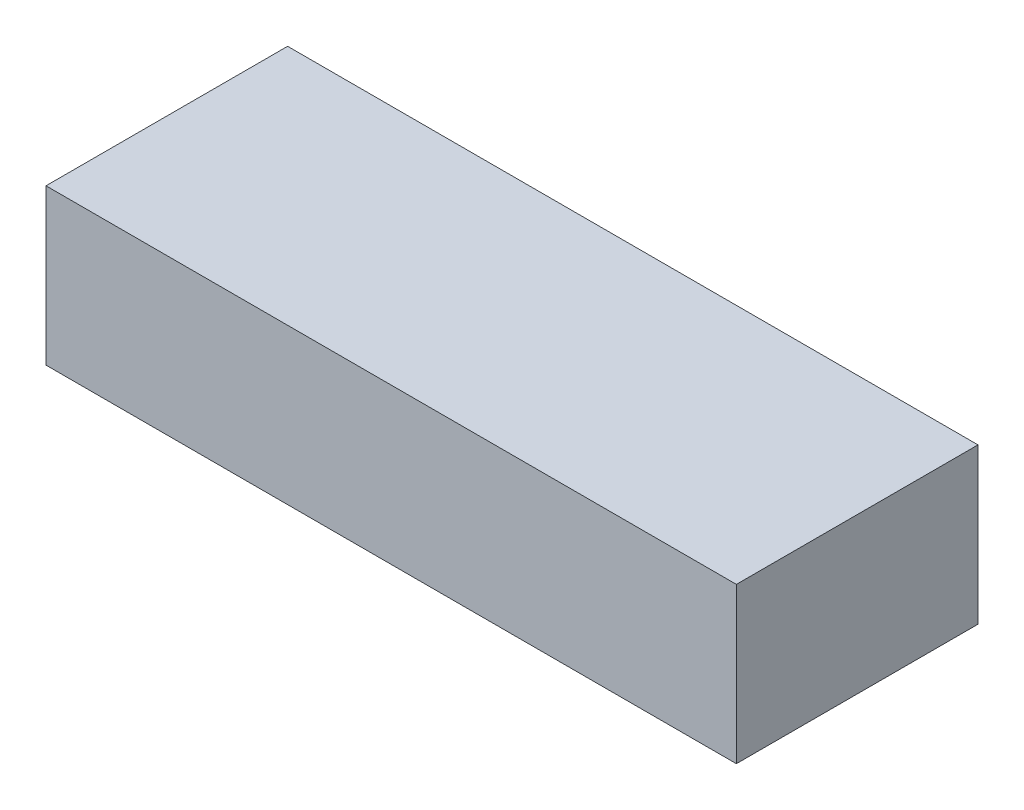
from build123d import *

# Parameters (mm, degrees)
SKETCH_1_W      = 40
SKETCH_1_H      = 14
EXTRUDE_1_DEPTH = 9


with BuildPart() as part:
    # 草图1 → 凸台-拉伸1 (new body)
    with BuildSketch(Plane(origin=(0, 0, 0), x_dir=(1, 0, 0), z_dir=(0, 1, 0))):
        Rectangle(SKETCH_1_W, SKETCH_1_H)
    extrude(amount=EXTRUDE_1_DEPTH)


solid = part.part
